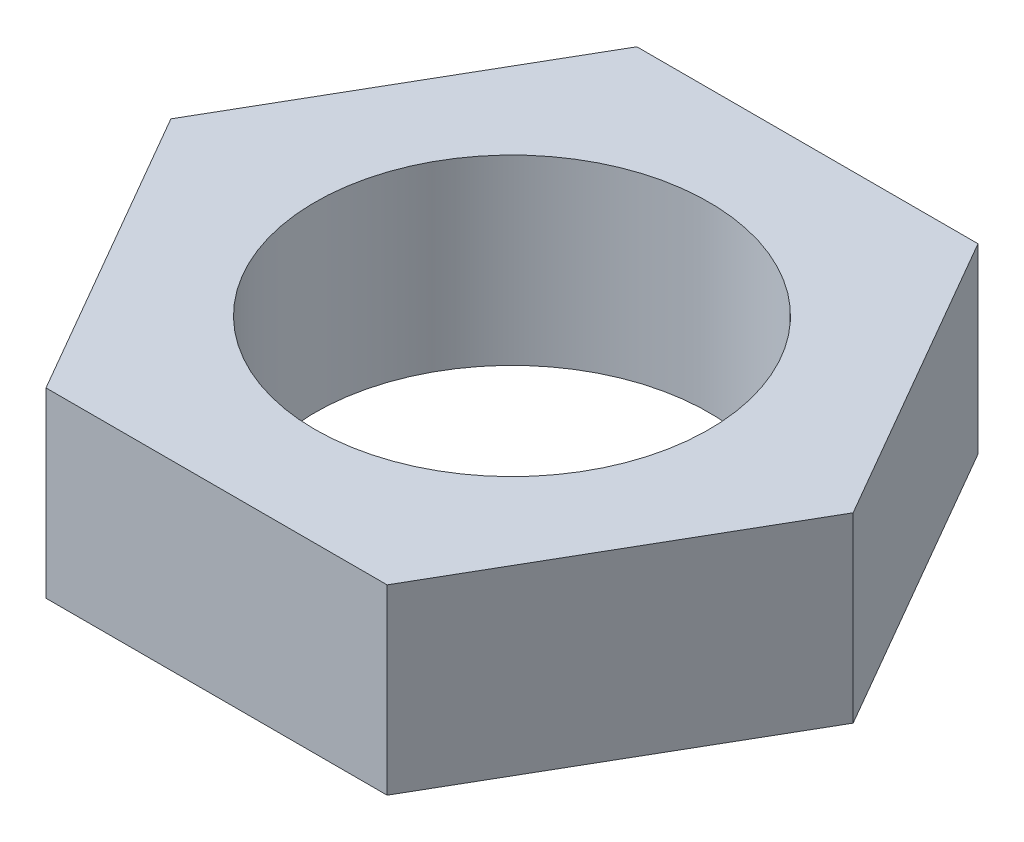
from build123d import *

# Parameters (mm, degrees)
SKETCH1_R           = 2
BOSS_EXTRUDE1_DEPTH = 1.85


with BuildPart() as part:
    # Sketch1 → Boss-Extrude1 (new body)
    with BuildSketch(Plane(origin=(0, 0, 0), x_dir=(1, 0, 0), z_dir=(0, 1, 0))):
        Polygon((3.464101615, 0), (1.732050808, 3), (-1.732050808, 3), (-3.464101615, 0), (-1.732050808, -3), (1.732050808, -3), align=None)
        with Locations(Location((0, 0, 0), (0, 0, 270))):
            Circle(SKETCH1_R, mode=Mode.SUBTRACT)
    extrude(amount=BOSS_EXTRUDE1_DEPTH)


solid = part.part
